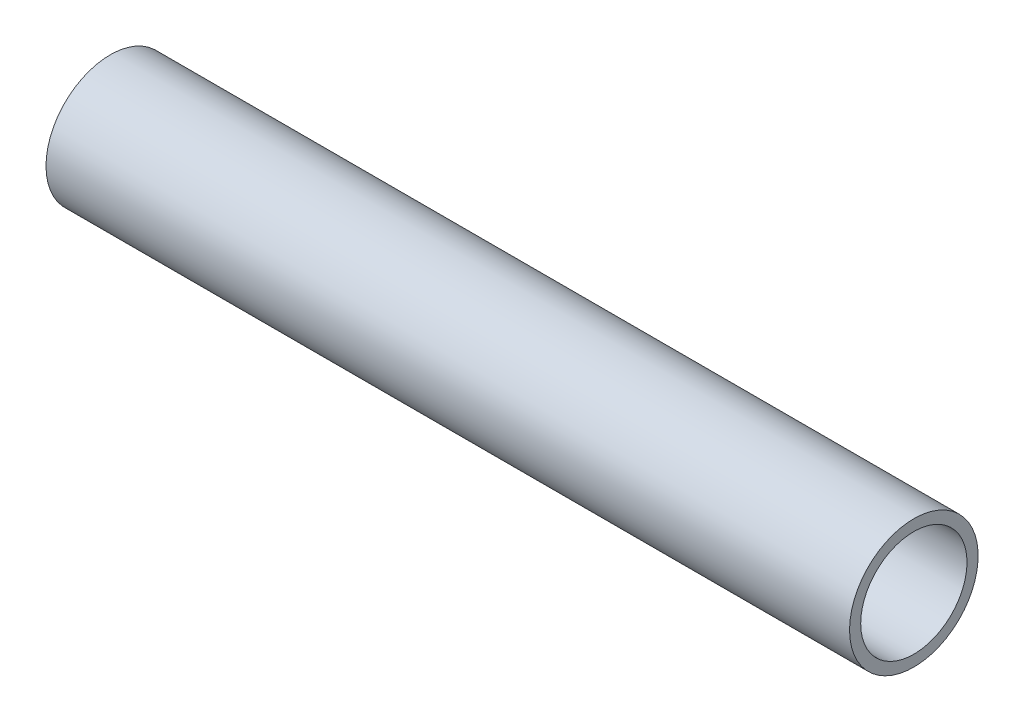
from build123d import *

# Parameters (mm, degrees)
SKETCH_1_R      = 50.8
SKETCH_1_R_2    = 42
EXTRUDE_1_DEPTH = 317.5


with BuildPart() as part:
    # 草图1 → 凸台-拉伸1 (new, symmetric)
    with BuildSketch(Plane(origin=(0, 0, 0), x_dir=(0, 0, -1), z_dir=(1, 0, 0))):
        with Locations(Location((0, 0, 0), (0, 0, 180))):
            Circle(SKETCH_1_R)
        with Locations(Location((0, 0, 0), (0, 0, 180))):
            Circle(SKETCH_1_R_2, mode=Mode.SUBTRACT)
    extrude(amount=EXTRUDE_1_DEPTH, both=True)


solid = part.part
